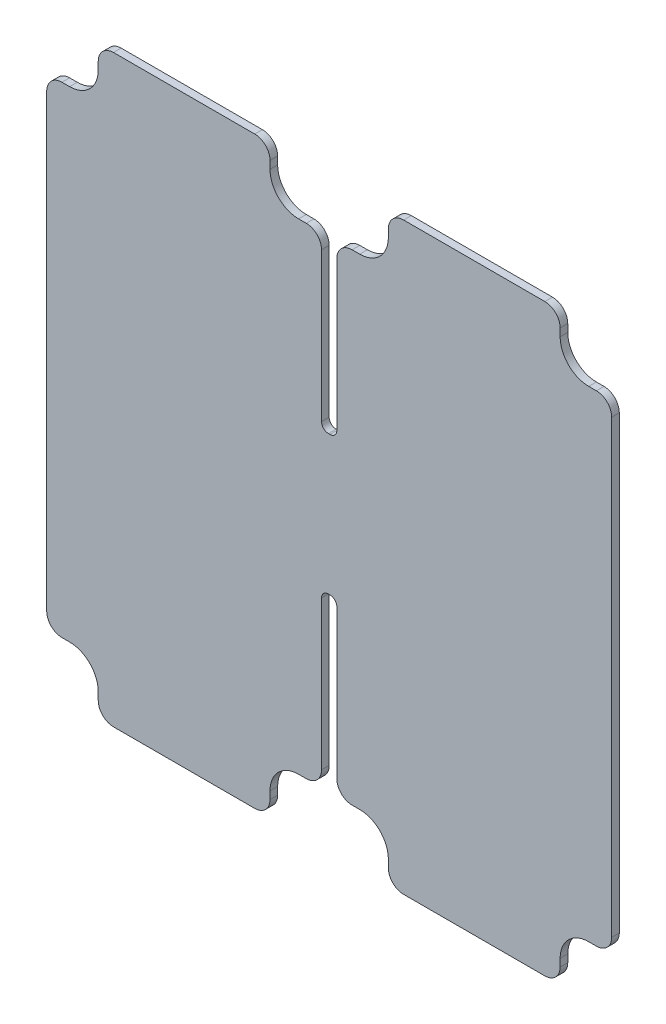
from build123d import *

# Parameters (mm, degrees)
BOSS_EXTRUDE1_DEPTH = 1


with BuildPart() as part:
    # Sketch2 → Boss-Extrude1 (new body)
    with BuildSketch(Plane.XY):
        with BuildLine():
            Line((41, 69.75), (40, 69.75))
            ThreePointArc((40, 69.75), (38.5858, 69.1642), (38, 67.75))
            Line((38, 67.75), (38, 48.25))
            ThreePointArc((38, 48.25), (37.736396103, 47.613603897), (37.1, 47.35))
            Line((37.1, 47.35), (36.9, 47.35))
            ThreePointArc((36.9, 47.35), (36.263603897, 47.613603897), (36, 48.25))
            Line((36, 48.25), (36, 67.75))
            ThreePointArc((36, 67.75), (35.4142, 69.1642), (34, 69.75))
            Line((34, 69.75), (33, 69.75))
            ThreePointArc((33, 69.75), (30.348375, 70.848375), (29.25, 73.5))
            Line((29.25, 73.5), (29.25, 74.5))
            ThreePointArc((29.25, 74.5), (28.6642, 75.9142), (27.25, 76.5))
            Line((27.25, 76.5), (8.75, 76.5))
            ThreePointArc((8.75, 76.5), (7.3358, 75.9142), (6.75, 74.5))
            Line((6.75, 74.5), (6.75, 73.5))
            ThreePointArc((6.75, 73.5), (5.651625, 70.848375), (3, 69.75))
            Line((3, 69.75), (2, 69.75))
            ThreePointArc((2, 69.75), (0.5858, 69.1642), (0, 67.75))
            Line((0, 67.75), (0, 8.75))
            ThreePointArc((0, 8.75), (0.5858, 7.3358), (2, 6.75))
            Line((2, 6.75), (3, 6.75))
            ThreePointArc((3, 6.75), (5.651625, 5.651625), (6.75, 3))
            Line((6.75, 3), (6.75, 2))
            ThreePointArc((6.75, 2), (7.3358, 0.5858), (8.75, 0))
            Line((8.75, 0), (27.25, 0))
            ThreePointArc((27.25, 0), (28.6642, 0.5858), (29.25, 2))
            Line((29.25, 2), (29.25, 3))
            ThreePointArc((29.25, 3), (30.348375, 5.651625), (33, 6.75))
            Line((33, 6.75), (34, 6.75))
            ThreePointArc((34, 6.75), (35.4142, 7.3358), (36, 8.75))
            Line((36, 8.75), (36, 28.25))
            ThreePointArc((36, 28.25), (36.263603897, 28.886396103), (36.9, 29.15))
            Line((36.9, 29.15), (37.1, 29.15))
            ThreePointArc((37.1, 29.15), (37.736396103, 28.886396103), (38, 28.25))
            Line((38, 28.25), (38, 8.75))
            ThreePointArc((38, 8.75), (38.5858, 7.3358), (40, 6.75))
            Line((40, 6.75), (41, 6.75))
            ThreePointArc((41, 6.75), (43.651625, 5.651625), (44.75, 3))
            Line((44.75, 3), (44.75, 2))
            ThreePointArc((44.75, 2), (45.3358, 0.5858), (46.75, 0))
            Line((46.75, 0), (65.25, 0))
            ThreePointArc((65.25, 0), (66.6642, 0.5858), (67.25, 2))
            Line((67.25, 2), (67.25, 3))
            ThreePointArc((67.25, 3), (68.348375, 5.651625), (71, 6.75))
            Line((71, 6.75), (72, 6.75))
            ThreePointArc((72, 6.75), (73.4142, 7.3358), (74, 8.75))
            Line((74, 8.75), (74, 67.75))
            ThreePointArc((74, 67.75), (73.4142, 69.1642), (72, 69.75))
            Line((72, 69.75), (71, 69.75))
            ThreePointArc((71, 69.75), (68.348375, 70.848375), (67.25, 73.5))
            Line((67.25, 73.5), (67.25, 74.5))
            ThreePointArc((67.25, 74.5), (66.6642, 75.9142), (65.25, 76.5))
            Line((65.25, 76.5), (46.75, 76.5))
            ThreePointArc((46.75, 76.5), (45.3358, 75.9142), (44.75, 74.5))
            Line((44.75, 74.5), (44.75, 73.5))
            ThreePointArc((44.75, 73.5), (43.651625, 70.848375), (41, 69.75))
        make_face()
    extrude(amount=BOSS_EXTRUDE1_DEPTH)


solid = part.part
